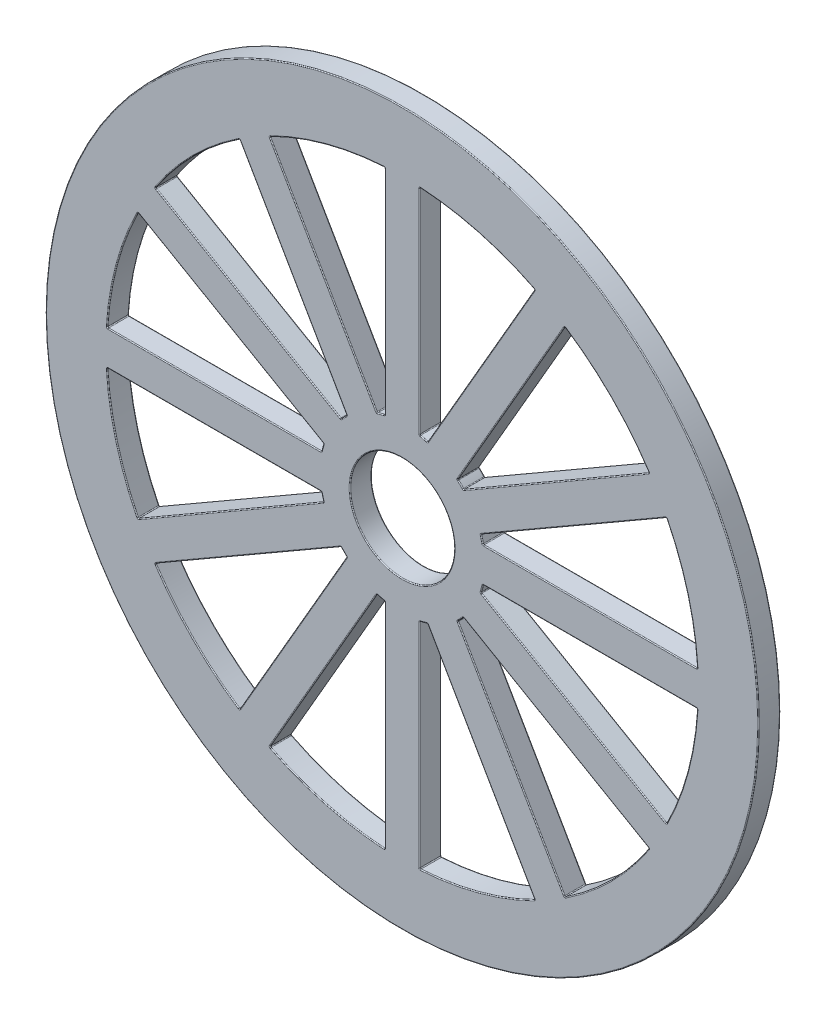
from build123d import *

# Parameters (mm, degrees)
ESBO_O1_R                = 41
ESBO_O1_R_2              = 6
RESSALTO_EXTRUS_O1_DEPTH = 2.5
FILETE1_R                = 0.1


with BuildPart() as part:
    # Esboço1 → Ressalto-extrusão1 (new body)
    with BuildSketch(Plane.XY):
        with Locations((-30.384760894, 14.465302898)):
            Circle(ESBO_O1_R)
        with BuildLine():
            Line((-32.384760894, 48.406428395), (-32.384760894, 23.752390708))
            ThreePointArc((-32.384760894, 23.752390708), (-32.843541822, 23.641598247), (-33.296253991, 23.508156869))
            Line((-33.296253991, 23.508156869), (-45.623272835, 44.859179811))
            ThreePointArc((-45.623272835, 44.859179811), (-39.184608427, 47.306780992), (-32.384760894, 48.406428395))
        make_face(mode=Mode.SUBTRACT)
        with BuildLine():
            Line((-28.384760894, 23.752390708), (-28.384760894, 48.406428395))
            ThreePointArc((-28.384760894, 48.406428395), (-21.58491336, 47.306780992), (-15.146248953, 44.859179811))
            Line((-15.146248953, 44.859179811), (-27.473267796, 23.508156869))
            ThreePointArc((-27.473267796, 23.508156869), (-27.925979965, 23.641598247), (-28.384760894, 23.752390708))
        make_face(mode=Mode.SUBTRACT)
        with BuildLine():
            Line((-49.08737445, 42.859179811), (-36.760355606, 21.508156869))
            ThreePointArc((-36.760355606, 21.508156869), (-37.102275315, 21.182817319), (-37.427614865, 20.840897611))
            Line((-37.427614865, 20.840897611), (-58.778637807, 33.167916454))
            ThreePointArc((-58.778637807, 33.167916454), (-54.426391454, 38.506933458), (-49.08737445, 42.859179811))
        make_face(mode=Mode.SUBTRACT)
        with BuildLine():
            Line((-24.009166181, 21.508156869), (-11.682147338, 42.859179811))
            ThreePointArc((-11.682147338, 42.859179811), (-6.343130333, 38.506933458), (-1.99088398, 33.167916454))
            Line((-1.99088398, 33.167916454), (-23.341906923, 20.840897611))
            ThreePointArc((-23.341906923, 20.840897611), (-23.667246472, 21.182817319), (-24.009166181, 21.508156869))
        make_face(mode=Mode.SUBTRACT)
        with BuildLine():
            Line((-60.778637807, 29.703814839), (-39.427614865, 17.376795995))
            ThreePointArc((-39.427614865, 17.376795995), (-39.561056243, 16.924083826), (-39.671848704, 16.465302898))
            Line((-39.671848704, 16.465302898), (-64.325886391, 16.465302898))
            ThreePointArc((-64.325886391, 16.465302898), (-63.226238987, 23.265150431), (-60.778637807, 29.703814839))
        make_face(mode=Mode.SUBTRACT)
        with BuildLine():
            Line((-21.341906923, 17.376795995), (0.00911602, 29.703814839))
            ThreePointArc((0.00911602, 29.703814839), (2.4567172, 23.265150431), (3.556364603, 16.465302898))
            Line((3.556364603, 16.465302898), (-21.097673083, 16.465302898))
            ThreePointArc((-21.097673083, 16.465302898), (-21.208465544, 16.924083826), (-21.341906923, 17.376795995))
        make_face(mode=Mode.SUBTRACT)
        with BuildLine():
            Line((-64.325886391, 12.465302898), (-39.671848704, 12.465302898))
            ThreePointArc((-39.671848704, 12.465302898), (-39.561056243, 12.006521969), (-39.427614865, 11.5538098))
            Line((-39.427614865, 11.5538098), (-60.778637807, -0.773209043))
            ThreePointArc((-60.778637807, -0.773209043), (-63.226238987, 5.665455364), (-64.325886391, 12.465302898))
        make_face(mode=Mode.SUBTRACT)
        with BuildLine():
            Line((-21.097673083, 12.465302898), (3.556364603, 12.465302898))
            ThreePointArc((3.556364603, 12.465302898), (2.4567172, 5.665455364), (0.00911602, -0.773209043))
            Line((0.00911602, -0.773209043), (-21.341906923, 11.5538098))
            ThreePointArc((-21.341906923, 11.5538098), (-21.208465544, 12.006521969), (-21.097673083, 12.465302898))
        make_face(mode=Mode.SUBTRACT)
        with BuildLine():
            Line((-58.778637807, -4.237310658), (-37.427614865, 8.089708185))
            ThreePointArc((-37.427614865, 8.089708185), (-37.102275315, 7.747788476), (-36.760355606, 7.422448927))
            Line((-36.760355606, 7.422448927), (-49.08737445, -13.928574016))
            ThreePointArc((-49.08737445, -13.928574016), (-54.426391454, -9.576327663), (-58.778637807, -4.237310658))
        make_face(mode=Mode.SUBTRACT)
        with BuildLine():
            Line((-23.341906923, 8.089708185), (-1.99088398, -4.237310658))
            ThreePointArc((-1.99088398, -4.237310658), (-6.343130333, -9.576327663), (-11.682147338, -13.928574016))
            Line((-11.682147338, -13.928574016), (-24.009166181, 7.422448927))
            ThreePointArc((-24.009166181, 7.422448927), (-23.667246472, 7.747788476), (-23.341906923, 8.089708185))
        make_face(mode=Mode.SUBTRACT)
        with BuildLine():
            Line((-45.623272835, -15.928574016), (-33.296253991, 5.422448927))
            ThreePointArc((-33.296253991, 5.422448927), (-32.843541822, 5.289007548), (-32.384760894, 5.178215087))
            Line((-32.384760894, 5.178215087), (-32.384760894, -19.475822599))
            ThreePointArc((-32.384760894, -19.475822599), (-39.184608427, -18.376175196), (-45.623272835, -15.928574016))
        make_face(mode=Mode.SUBTRACT)
        with BuildLine():
            Line((-27.473267796, 5.422448927), (-15.146248953, -15.928574016))
            ThreePointArc((-15.146248953, -15.928574016), (-21.58491336, -18.376175196), (-28.384760894, -19.475822599))
            Line((-28.384760894, -19.475822599), (-28.384760894, 5.178215087))
            ThreePointArc((-28.384760894, 5.178215087), (-27.925979965, 5.289007548), (-27.473267796, 5.422448927))
        make_face(mode=Mode.SUBTRACT)
        with Locations((-30.384760894, 14.465302898)):
            Circle(ESBO_O1_R_2, mode=Mode.SUBTRACT)
    extrude(amount=RESSALTO_EXTRUS_O1_DEPTH)

    # Filete1
    filete1_edges = [part.edges().sort_by_distance(p)[0] for p in [
        (-63.226238987, 23.265150431, 2.5),
        (-50.103126336, 23.540305417, 2.5),
        (-39.561056243, 16.924083826, 2.5),
        (-51.998867547, 16.465302898, 2.5),
        (-54.426391454, 38.506933458, 2.5),
        (-42.923865028, 32.18366834, 2.5),
        (-37.102275315, 21.182817319, 2.5),
        (-48.103126336, 27.004407032, 2.5),
        (-39.184608427, 47.306780992, 2.5),
        (-32.384760894, 36.079409551, 2.5),
        (-32.843541822, 23.641598247, 2.5),
        (-39.459763413, 34.18366834, 2.5),
        (-21.58491336, 47.306780992, 2.5),
        (-21.309758374, 34.18366834, 2.5),
        (-27.925979965, 23.641598247, 2.5),
        (-28.384760894, 36.079409551, 2.5),
        (-6.343130333, 38.506933458, 2.5),
        (-12.666395451, 27.004407032, 2.5),
        (-23.667246472, 21.182817319, 2.5),
        (-17.845656759, 32.18366834, 2.5),
        (2.4567172, 5.665455364, 2.5),
        (-8.77065424, 16.465302898, 2.5),
        (-21.208465544, 16.924083826, 2.5),
        (-10.666395451, 23.540305417, 2.5),
        (2.4567172, 23.265150431, 2.5),
        (-36.384760894, 14.465302898, 2.5),
        (-71.384760894, 14.465302898, 2.5),
        (-10.666395451, 5.390300378, 2.5),
        (-21.208465544, 12.006521969, 2.5),
        (-8.77065424, 12.465302898, 2.5),
        (-6.343130333, -9.576327663, 2.5),
        (-17.845656759, -3.253062544, 2.5),
        (-23.667246472, 7.747788476, 2.5),
        (-12.666395451, 1.926198763, 2.5),
        (-21.58491336, -18.376175196, 2.5),
        (-28.384760894, -7.148803756, 2.5),
        (-71.384760894, 14.465302898, 0),
        (-36.384760894, 14.465302898, 0),
        (2.4567172, 23.265150431, 0),
        (-10.666395451, 23.540305417, 0),
        (-21.208465544, 16.924083826, 0),
        (-8.77065424, 16.465302898, 0),
        (-17.845656759, 32.18366834, 0),
        (-23.667246472, 21.182817319, 0),
        (-27.925979965, 5.289007548, 2.5),
        (-12.666395451, 27.004407032, 0),
        (-6.343130333, 38.506933458, 0),
        (-28.384760894, 36.079409551, 0),
        (-27.925979965, 23.641598247, 0),
        (-21.309758374, 34.18366834, 0),
        (-21.58491336, 47.306780992, 0),
        (-21.309758374, -5.253062544, 2.5),
        (-39.459763413, 34.18366834, 0),
        (-32.843541822, 23.641598247, 0),
        (-32.384760894, 36.079409551, 0),
        (-39.184608427, 47.306780992, 0),
        (-48.103126336, 27.004407032, 0),
        (-37.102275315, 21.182817319, 0),
        (-42.923865028, 32.18366834, 0),
        (-54.426391454, 38.506933458, 0),
        (-39.184608427, -18.376175196, 2.5),
        (-51.998867547, 16.465302898, 0),
        (-39.561056243, 16.924083826, 0),
        (-50.103126336, 23.540305417, 0),
        (-63.226238987, 23.265150431, 0),
        (-50.103126336, 5.390300378, 0),
        (-39.561056243, 12.006521969, 0),
        (-39.459763413, -5.253062544, 2.5),
        (-51.998867547, 12.465302898, 0),
        (-63.226238987, 5.665455364, 0),
        (-42.923865028, -3.253062544, 0),
        (-37.102275315, 7.747788476, 0),
        (-48.103126336, 1.926198763, 0),
        (-54.426391454, -9.576327663, 0),
        (-32.384760894, -7.148803756, 0),
        (-32.843541822, 5.289007548, 0),
        (-32.843541822, 5.289007548, 2.5),
        (-39.459763413, -5.253062544, 0),
        (-39.184608427, -18.376175196, 0),
        (-21.309758374, -5.253062544, 0),
        (-27.925979965, 5.289007548, 0),
        (-28.384760894, -7.148803756, 0),
        (-21.58491336, -18.376175196, 0),
        (-32.384760894, -7.148803756, 2.5),
        (-12.666395451, 1.926198763, 0),
        (-23.667246472, 7.747788476, 0),
        (-17.845656759, -3.253062544, 0),
        (-6.343130333, -9.576327663, 0),
        (-8.77065424, 12.465302898, 0),
        (-21.208465544, 12.006521969, 0),
        (-10.666395451, 5.390300378, 0),
        (2.4567172, 5.665455364, 0),
        (-54.426391454, -9.576327663, 2.5),
        (-48.103126336, 1.926198763, 2.5),
        (-37.102275315, 7.747788476, 2.5),
        (-42.923865028, -3.253062544, 2.5),
        (3.556364603, 16.465302898, 1.25),
        (0.00911602, 29.703814839, 1.25),
        (-21.341906923, 17.376795995, 1.25),
        (-21.097673083, 16.465302898, 1.25),
        (-11.682147338, 42.859179811, 1.25),
        (-24.009166181, 21.508156869, 1.25),
        (-23.341906923, 20.840897611, 1.25),
        (-1.99088398, 33.167916454, 1.25),
        (-28.384760894, 48.406428395, 1.25),
        (-28.384760894, 23.752390708, 1.25),
        (-27.473267796, 23.508156869, 1.25),
        (-15.146248953, 44.859179811, 1.25),
        (-45.623272835, 44.859179811, 1.25),
        (-63.226238987, 5.665455364, 2.5),
        (-33.296253991, 23.508156869, 1.25),
        (-32.384760894, 23.752390708, 1.25),
        (-32.384760894, 48.406428395, 1.25),
        (-58.778637807, 33.167916454, 1.25),
        (-37.427614865, 20.840897611, 1.25),
        (-36.760355606, 21.508156869, 1.25),
        (-49.08737445, 42.859179811, 1.25),
        (-64.325886391, 16.465302898, 1.25),
        (-39.671848704, 16.465302898, 1.25),
        (-39.427614865, 17.376795995, 1.25),
        (-60.778637807, 29.703814839, 1.25),
        (-60.778637807, -0.773209043, 1.25),
        (-39.427614865, 11.5538098, 1.25),
        (-39.671848704, 12.465302898, 1.25),
        (-64.325886391, 12.465302898, 1.25),
        (-49.08737445, -13.928574016, 1.25),
        (-36.760355606, 7.422448927, 1.25),
        (-37.427614865, 8.089708185, 1.25),
        (-58.778637807, -4.237310658, 1.25),
        (-32.384760894, -19.475822599, 1.25),
        (-32.384760894, 5.178215087, 1.25),
        (-33.296253991, 5.422448927, 1.25),
        (-45.623272835, -15.928574016, 1.25),
        (-15.146248953, -15.928574016, 1.25),
        (-27.473267796, 5.422448927, 1.25),
        (-28.384760894, 5.178215087, 1.25),
        (-28.384760894, -19.475822599, 1.25),
        (-1.99088398, -4.237310658, 1.25),
        (-23.341906923, 8.089708185, 1.25),
        (-24.009166181, 7.422448927, 1.25),
        (-51.998867547, 12.465302898, 2.5),
        (-11.682147338, -13.928574016, 1.25),
        (3.556364603, 12.465302898, 1.25),
        (-21.097673083, 12.465302898, 1.25),
        (-21.341906923, 11.5538098, 1.25),
        (0.00911602, -0.773209043, 1.25),
        (-39.561056243, 12.006521969, 2.5),
        (-50.103126336, 5.390300378, 2.5),
    ]]
    fillet(filete1_edges, radius=FILETE1_R)


solid = part.part
